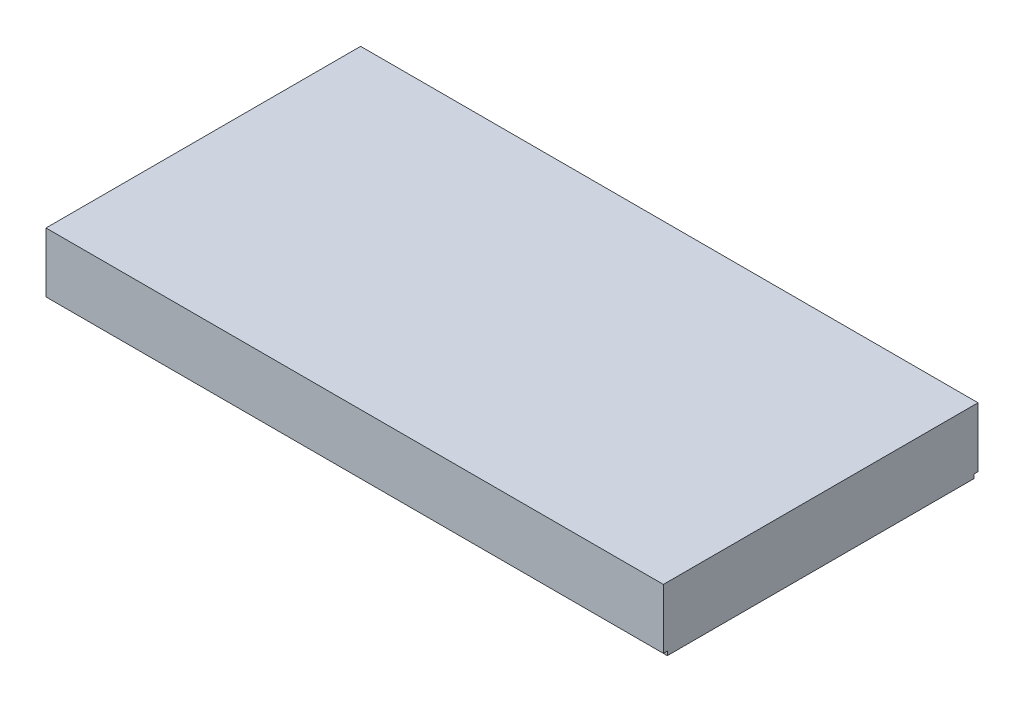
from build123d import *

# Parameters (mm, degrees)
MAINBASESKETCH_W              = 47.8
MAINBASESKETCH_H              = 3.2
MAINBASEEXTRUDE_DEPTH         = 7.9
MAINBASESHELL_T               = -1.2
UNDERSIDECIRCLEEXT_START      = -0.2
UNDERSIDECIRCLESKETCH_R       = 3.1
UNDERSIDECIRCLESKETCH_R_2     = 2.4
UNDERSIDECIRCLEEXT_DEPTH      = 2.4
UNDERSIDECIRCLEPATTERN_COUNT  = 3
UNDERSIDECIRCLEPATTERN_PITCH  = 8
EXTENDEDBASEEDGECUT_DEPTH     = 0.2
EXTENDEDBASEEDGECUT2_DEPTH    = 0.2
EXTENDEDBASEEDGECUT3_DEPTH    = 0.2
EXTENDEDBASEEDGESKETCH4_W     = 47.4
EXTENDEDBASEEDGESKETCH4_H     = 0.199766916
EXTENDEDBASEEDGECUT4_DEPTH    = 0.2
EXTENDEDNBASEUNDERNOTCH_DEPTH = 0.4
EXTENDEBASENOTCHFILLET_R      = 0.2
CUT_EXTRUDE60_DEPTH           = 50.170632952
CUT_EXTRUDE60_DEPTH_BACK      = 50.170632952
SKETCH178_W                   = 15.972643613
SKETCH178_H                   = 15.8
SKETCH179_W                   = 1.2
SKETCH179_H                   = 13.4
SKETCH180_W                   = 0.411945133
SKETCH180_H                   = 15.8
CUT_EXTRUDE61_DEPTH           = 34.627758191


with BuildPart() as part:
    # MainBaseSketch → MainBaseExtrude (new, symmetric)
    with BuildSketch(Plane.XY):
        with Locations((24.581967213, 1.6)):
            Rectangle(MAINBASESKETCH_W, MAINBASESKETCH_H)
    extrude(amount=MAINBASEEXTRUDE_DEPTH, both=True)

    # MainBaseShell
    mainbaseshell_openings = [part.faces().sort_by_distance(p)[0] for p in [
        (24.581967213, 0, 0),
    ]]
    offset(amount=MAINBASESHELL_T, openings=mainbaseshell_openings, kind=Kind.INTERSECTION)

    # UnderSideCircleSketch → UnderSideCircleExt (add)
    with BuildSketch(Plane.XZ.offset(-2).offset(UNDERSIDECIRCLEEXT_START)):
        with Locations((8.581967213, 0)):
            Circle(UNDERSIDECIRCLESKETCH_R)
        with Locations((8.581967213, 0)):
            Circle(UNDERSIDECIRCLESKETCH_R_2, mode=Mode.SUBTRACT)
    undersidecircleext = extrude(amount=UNDERSIDECIRCLEEXT_DEPTH)

    # UnderSideCirclePattern: UnderSideCircleExt ×3
    with Locations(*[(i * UNDERSIDECIRCLEPATTERN_PITCH, 0, 0) for i in range(1, UNDERSIDECIRCLEPATTERN_COUNT)]):
        add(undersidecircleext)

    # ExtendedBaseEdgeSketch → ExtendedBaseEdgeCut (cut)
    with BuildSketch(Plane.ZY.offset(-0.681967213)):
        Polygon((-7.9, 0), (-7.9, 0.199766916), (-7.702184024, 0.199766916), (7.702184024, 0.199766916), (7.9, 0.199766916), (7.9, 0), (7.702184024, 0), (-7.702184024, 0), align=None)
    extrude(amount=-EXTENDEDBASEEDGECUT_DEPTH, mode=Mode.SUBTRACT)

    # ExtendedBaseEdgeSketch2 → ExtendedBaseEdgeCut2 (cut)
    with BuildSketch(Plane(origin=(0, 0, -7.9), x_dir=(-1, 0, 0), z_dir=(0, 0, -1))):
        Polygon((-48.481967213, 0), (-48.481967213, 0.203418418), (-0.881967213, 0.199766916), (-0.881967213, 0), align=None)
    extrude(amount=-EXTENDEDBASEEDGECUT2_DEPTH, mode=Mode.SUBTRACT)

    # ExtendedBaseEdgeSketch3 → ExtendedBaseEdgeCut3 (cut)
    with BuildSketch(Plane(origin=(48.481967213, 0, 0), x_dir=(0, 0, -1), z_dir=(1, 0, 0))):
        Polygon((-7.9, 0), (-7.9, 0.199766916), (7.7, 0.203418418), (7.7, 0), align=None)
    extrude(amount=-EXTENDEDBASEEDGECUT3_DEPTH, mode=Mode.SUBTRACT)

    # ExtendedBaseEdgeSketch4 → ExtendedBaseEdgeCut4 (cut)
    with BuildSketch(Plane.XY.offset(7.9)):
        with Locations((24.581967213, 0.099883458)):
            Rectangle(EXTENDEDBASEEDGESKETCH4_W, EXTENDEDBASEEDGESKETCH4_H)
    extrude(amount=-EXTENDEDBASEEDGECUT4_DEPTH, mode=Mode.SUBTRACT)

    # ExtendedbaseUnderNotchSketch → ExtendednbaseUnderNotch (cut)
    with BuildSketch(Plane.XZ.offset(-2)):
        Polygon((1.881967213, 0), (1.881967213, 2.502100162), (2.381942481, 2.502100162), (2.381942481, -2.499482153), (1.881967213, -2.499482153), align=None)
    extrude(amount=-EXTENDEDNBASEUNDERNOTCH_DEPTH, mode=Mode.SUBTRACT)

    # ExtendebaseNotchFillet
    extendebasenotchfillet_edges = [part.edges().sort_by_distance(p)[0] for p in [
        (1.881967213, 2.4, 0.001309004),
        (2.131954847, 2.4, 2.502100162),
        (2.381942481, 2.4, 0.001309004),
        (2.131954847, 2.4, -2.499482153),
    ]]
    fillet(extendebasenotchfillet_edges, radius=EXTENDEBASENOTCHFILLET_R)

    # Sketch178 → Cut-Extrude60 (cut, two sides: drawn at the far end of the back side and taken through both)
    with BuildSketch(Plane(origin=(0, 2, 0), x_dir=(-1, 0, 0), z_dir=(0, -1, 0)).offset(-CUT_EXTRUDE60_DEPTH_BACK)):
        with Locations((-40.495645407, 0)):
            Rectangle(SKETCH178_W, SKETCH178_H)
    extrude(amount=CUT_EXTRUDE60_DEPTH + CUT_EXTRUDE60_DEPTH_BACK, mode=Mode.SUBTRACT)

    # Sweep29: sweep along a curve in space
    with BuildLine() as sweep29_path:
        Line((32.5093236, 0, 6.7), (32.5093236, 2, 6.7))
    # Sketch179 → Sweep29 (sweep)
    with BuildSketch(Plane.XZ):
        with Locations((31.9093236, 0)):
            Rectangle(SKETCH179_W, SKETCH179_H)
    sweep(path=sweep29_path.line)

    # Sketch180 → Cut-Extrude61 (cut, through all)
    with BuildSketch(Plane(origin=(0, 3.2, 0), x_dir=(1, 0, 0), z_dir=(0, 1, 0))):
        with Locations((0.88793978, 0)):
            Rectangle(SKETCH180_W, SKETCH180_H)
        with Locations((32.303351034, 0)):
            Rectangle(SKETCH180_W, SKETCH180_H)
    extrude(amount=-CUT_EXTRUDE61_DEPTH, mode=Mode.SUBTRACT)


solid = part.part
